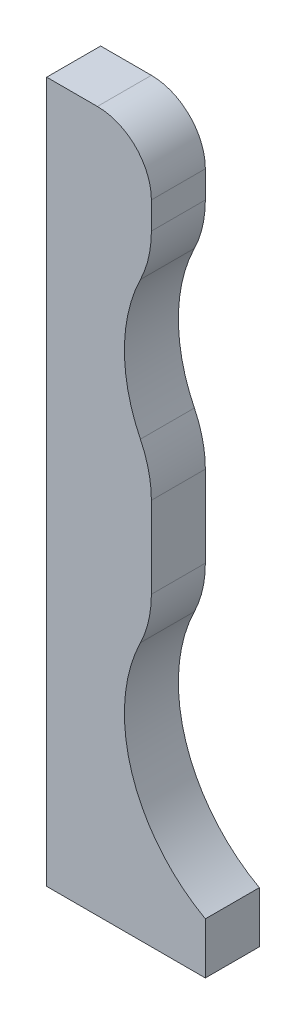
from build123d import *

# Parameters (mm, degrees)
BOSS_EXTRUDE1_DEPTH = 3.175


with BuildPart() as part:
    # Sketch1 → Boss-Extrude1 (new body)
    with BuildSketch(Plane.XY):
        with BuildLine():
            Line((3197.644121692, 2688.563651274), (3197.644121692, 2647.335396863))
            Line((3197.644121692, 2647.335396863), (3206.978621692, 2647.335396863))
            Line((3206.978621692, 2647.335396863), (3206.978621692, 2650.349327172))
            ThreePointArc((3206.978621692, 2650.349327172), (3202.641918543, 2655.664582974), (3203.157508546, 2662.505131592))
            ThreePointArc((3203.157508546, 2662.505131592), (3203.639984983, 2663.86358759), (3203.803621692, 2665.29586174))
            Line((3203.803621692, 2665.29586174), (3203.803621692, 2670.086113793))
            ThreePointArc((3203.803621692, 2670.086113793), (3203.639984983, 2671.518387942), (3203.157508546, 2672.876843941))
            ThreePointArc((3203.157508546, 2672.876843941), (3202.216121692, 2676.942937766), (3203.157508546, 2681.009031592))
            ThreePointArc((3203.157508546, 2681.009031592), (3203.639984983, 2682.36748759), (3203.803621692, 2683.79976174))
            Line((3203.803621692, 2683.79976174), (3203.803621692, 2685.388651274))
            ThreePointArc((3203.803621692, 2685.388651274), (3202.873685722, 2687.633715304), (3200.628621692, 2688.563651274))
            Line((3200.628621692, 2688.563651274), (3197.644121692, 2688.563651274))
        make_face()
    extrude(amount=BOSS_EXTRUDE1_DEPTH)


solid = part.part
